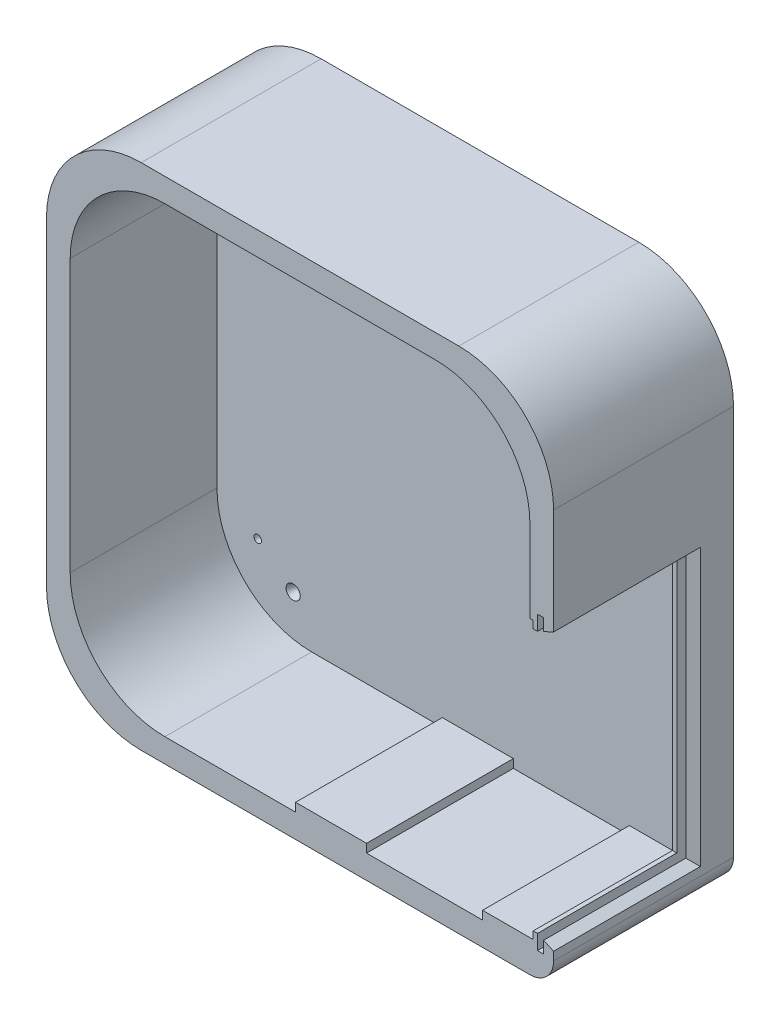
from build123d import *
from OCP.BRepFilletAPI import BRepFilletAPI_MakeChamfer

# Parameters (mm, degrees)
SKETCH1_W           = 97.1
SKETCH1_H           = 97.5
SKETCH1_R           = 0.8
BOSS_EXTRUDE1_DEPTH = 7
CUT_EXTRUDE1_DEPTH  = 3
SKETCH3_W           = 107.1
SKETCH3_H           = 107.5
SKETCH3_W_2         = 97.1
SKETCH3_H_2         = 97.5
BOSS_EXTRUDE2_DEPTH = 7
SKETCH4_W           = 107.1
SKETCH4_H           = 107.5
SKETCH4_W_2         = 97.1
SKETCH4_H_2         = 97.5
BOSS_EXTRUDE3_DEPTH = 31
SKETCH5_W           = 31
SKETCH5_H           = 58
CUT_EXTRUDE2_DEPTH  = 33
MOVE_FACE2_BY       = 10
MOVE_FACE3_BY       = 0.2
SKETCH6_W           = 15
SKETCH6_H           = 31
BOSS_EXTRUDE4_DEPTH = 1.8
MOVE_FACE4_BY       = 0.2
BOSS_EXTRUDE5_DEPTH = 31
BOSS_EXTRUDE6_DEPTH = 58.4
SKETCH13_R          = 1.5
SKETCH14_R          = 0.8
SKETCH13_4_R        = 1.5
SKETCH14_4_R        = 0.8
FILLET2_R           = 20
FILLET3_R           = 20
FILLET4_R           = 20
FILLET5_R           = 20
FILLET6_R           = 5
CHAMFER1_SIZE       = 1
CHAMFER1_SIZE2      = 0.421668948
SKETCH16_R          = 0.8
CUT_EXTRUDE3_DEPTH  = 87.094424907
SKETCH20_W          = 1.3
SKETCH20_H          = 61.543461502
CUT_EXTRUDE4_DEPTH  = 32.62
BOSS_EXTRUDE7_DEPTH = 20
SKETCH25_R          = 7.25
BOSS_EXTRUDE8_DEPTH = 4.5
SKETCH24_R          = 5.75
SKETCH23_R          = 4
SKETCH26_R          = 4
CUT_EXTRUDE5_DEPTH  = 4.5
CUT_EXTRUDE6_DEPTH  = 34.5
CUT_EXTRUDE7_DEPTH  = 34.5
SKETCH34_R          = 3
CUT_EXTRUDE9_DEPTH  = 3
SKETCH36_R          = 1.5
SKETCH35_R          = 0.8
SKETCH36_3_R        = 1.5
SKETCH35_3_R        = 0.8


with BuildPart() as part:
    # Sketch1 → Boss-Extrude1 (new body)
    with BuildSketch(Plane.XY):
        with Locations((0.95, -5.25)):
            Rectangle(SKETCH1_W, SKETCH1_H)
        with Locations((-31.5, -45)):
            Circle(SKETCH1_R, mode=Mode.SUBTRACT)
        with Locations((26, 39)):
            Circle(SKETCH1_R, mode=Mode.SUBTRACT)
    extrude(amount=BOSS_EXTRUDE1_DEPTH)

    # Sketch2 → Cut-Extrude1 (cut)
    with BuildSketch(Plane(origin=(0, 0, 0), x_dir=(-1, 0, 0), z_dir=(0, 0, -1))):
        Polygon((-24.4, 36.228718708), (-22.8, 39), (-24.4, 41.771281292), (-27.6, 41.771281292), (-29.2, 39), (-27.6, 36.228718708), align=None)
        Polygon((33.1, -47.771281292), (34.7, -45), (33.1, -42.228718708), (29.9, -42.228718708), (28.3, -45), (29.9, -47.771281292), align=None)
    extrude(amount=-CUT_EXTRUDE1_DEPTH, mode=Mode.SUBTRACT)

    # Sketch3 → Boss-Extrude2 (add)
    with BuildSketch(Plane.XY.offset(7)):
        with Locations((0.95, -5.25)):
            Rectangle(SKETCH3_W, SKETCH3_H)
        with Locations((0.95, -5.25)):
            Rectangle(SKETCH3_W_2, SKETCH3_H_2, mode=Mode.SUBTRACT)
    extrude(amount=-BOSS_EXTRUDE2_DEPTH)

    # Sketch4 → Boss-Extrude3 (add)
    with BuildSketch(Plane.XY.offset(7)):
        with Locations((0.95, -5.25)):
            Rectangle(SKETCH4_W, SKETCH4_H)
        with Locations((0.95, -5.25)):
            Rectangle(SKETCH4_W_2, SKETCH4_H_2, mode=Mode.SUBTRACT)
    extrude(amount=BOSS_EXTRUDE3_DEPTH)

    # Sketch5 → Cut-Extrude2 (cut)
    with BuildSketch(Plane(origin=(54.5, 0, 0), x_dir=(0, 0, -1), z_dir=(1, 0, 0))):
        with Locations((-22.5, -23)):
            Rectangle(SKETCH5_W, SKETCH5_H)
    extrude(amount=-CUT_EXTRUDE2_DEPTH, mode=Mode.SUBTRACT)

    # Move Face2: a face moved outward by 10.0
    extrude(part.faces().sort_by_distance((49.5, -53, 22.5))[0], amount=MOVE_FACE2_BY, dir=(-1, 0, 0))

    # Move Face3: a face moved inward by 0.2
    extrude(part.faces().sort_by_distance((47, -52, 22.5))[0], amount=MOVE_FACE3_BY, dir=(0, -1, 0), mode=Mode.SUBTRACT)

    # Sketch6 → Boss-Extrude4 (add)
    with BuildSketch(Plane(origin=(0, -54, 0), x_dir=(1, 0, 0), z_dir=(0, 1, 0))):
        with Locations((7.5, -22.5)):
            Rectangle(SKETCH6_W, SKETCH6_H)
    extrude(amount=BOSS_EXTRUDE4_DEPTH)

    # Move Face4: a face moved inward by 0.2
    extrude(part.faces().sort_by_distance((52, 6, 22.5))[0], amount=MOVE_FACE4_BY, dir=(0, 1, 0), mode=Mode.SUBTRACT)

    # Sketch10 → Boss-Extrude5 (add)
    with BuildSketch(Plane.XY.offset(7)):
        Polygon((54.5, 6.2), (50.2, 6.2), (50.2, 4.2), align=None)
        Polygon((54.5, -52.2), (50.2, -52.2), (50.2, -50.2), align=None)
    extrude(amount=BOSS_EXTRUDE5_DEPTH)

    # Sketch11 → Boss-Extrude6 (add)
    with BuildSketch(Plane.XZ.offset(-6.2)):
        Polygon((50.2, 7), (54.5, 7), (50.2, 9), align=None)
    extrude(amount=BOSS_EXTRUDE6_DEPTH)

    # Sketch13 → Cut-Loft1 section 0
    with BuildSketch(Plane.XY.offset(7)):
        with Locations((-31.5, -45)):
            Circle(SKETCH13_R)
    # Sketch14 → Cut-Loft1 section 1
    with BuildSketch(Plane.XY.offset(5.4)):
        with Locations((-31.5, -45)):
            Circle(SKETCH14_R)
    loft(mode=Mode.SUBTRACT)

    # Sketch13<4> → Cut-Loft2 section 0
    with BuildSketch(Plane.XY.offset(7)):
        with Locations((26, 39)):
            Circle(SKETCH13_4_R)
    # Sketch14<4> → Cut-Loft2 section 1
    with BuildSketch(Plane.XY.offset(5.4)):
        with Locations((26, 39)):
            Circle(SKETCH14_4_R)
    loft(mode=Mode.SUBTRACT)

    # Fillet2
    fillet2_edges = [part.edges().sort_by_distance(p)[0] for p in [
        (-47.6, 43.5, 22.5),
    ]]
    fillet(fillet2_edges, radius=FILLET2_R)

    # Fillet3
    fillet3_edges = [part.edges().sort_by_distance(p)[0] for p in [
        (-47.6, -54, 22.5),
    ]]
    fillet(fillet3_edges, radius=FILLET3_R)

    # Fillet4
    fillet4_edges = [part.edges().sort_by_distance(p)[0] for p in [
        (49.5, 43.5, 22.5),
    ]]
    fillet(fillet4_edges, radius=FILLET4_R)

    # Fillet5
    fillet5_edges = [part.edges().sort_by_distance(p)[0] for p in [
        (-52.6, 48.5, 19),
        (54.5, 48.5, 19),
        (-52.6, -59, 19),
    ]]
    fillet(fillet5_edges, radius=FILLET5_R)

    # Fillet6
    fillet6_edges = [part.edges().sort_by_distance(p)[0] for p in [
        (54.5, -59, 19),
    ]]
    fillet(fillet6_edges, radius=FILLET6_R)

    # Chamfer1: one chamfer whose edges measure the first distance from different faces: ONE call of the kernel's chamfer builder (chamfer() names one face for all edges)
    chamfer1_edges_1 = [part.edges().sort_by_distance(p)[0] for p in [
        (50.2, 4.2, 23.5),
    ]]
    chamfer1_side_1 = [part.faces().sort_by_distance(p)[0] for p in [
        (52.373888889, 5.211111111, 22.994444444),
    ]]
    chamfer1_edges_2 = [part.edges().sort_by_distance(p)[0] for p in [
        (50.2, -50.2, 23.5),
    ]]
    chamfer1_side_2 = [part.faces().sort_by_distance(p)[0] for p in [
        (52.373888889, -51.211111111, 22.994444444),
    ]]
    chamfer1_edges_3 = [part.edges().sort_by_distance(p)[0] for p in [
        (50.2, -23, 9),
    ]]
    chamfer1_side_3 = [part.faces().sort_by_distance(p)[0] for p in [
        (52.375413712, -23, 7.988179669),
    ]]
    chamfer1 = BRepFilletAPI_MakeChamfer(part.part.solid().wrapped)
    for e in chamfer1_edges_1:
        chamfer1.Add(CHAMFER1_SIZE, CHAMFER1_SIZE2, e.wrapped, chamfer1_side_1[0].wrapped)  # the first distance lies on this face
    for e in chamfer1_edges_2:
        chamfer1.Add(CHAMFER1_SIZE, CHAMFER1_SIZE2, e.wrapped, chamfer1_side_2[0].wrapped)  # the first distance lies on this face
    for e in chamfer1_edges_3:
        chamfer1.Add(CHAMFER1_SIZE, CHAMFER1_SIZE2, e.wrapped, chamfer1_side_3[0].wrapped)  # the first distance lies on this face
    add(Compound.cast(chamfer1.Shape()), mode=Mode.REPLACE)

    # Sketch16 → Cut-Extrude3 (cut, through all)
    with BuildSketch(Plane.XY.offset(7)):
        with Locations((32, 32)):
            Circle(SKETCH16_R)
        with Locations((-39, -39)):
            Circle(SKETCH16_R)
    extrude(amount=-CUT_EXTRUDE3_DEPTH, mode=Mode.SUBTRACT)

    # Sketch20 → Cut-Extrude4 (cut)
    with BuildSketch(Plane.XY.offset(38)):
        with Locations((51.756630498, -23)):
            Rectangle(SKETCH20_W, SKETCH20_H)
    extrude(amount=-CUT_EXTRUDE4_DEPTH, mode=Mode.SUBTRACT)


with BuildPart() as body_2:
    # Sketch21 → Boss-Extrude7 (new body)
    with BuildSketch(Plane.XY.offset(7)):
        with BuildLine():
            ThreePointArc((44.045644952, 24.711613463), (46.890543586, 26.651851916), (48.519348561, 29.685820908))
            ThreePointArc((48.519348561, 29.685820908), (47.841657822, 31.4739318), (46.996296574, 33.189148889))
            ThreePointArc((46.996296574, 33.189148889), (47.186220419, 32.354047627), (47.25, 31.5))
            ThreePointArc((47.25, 31.5), (36.295038241, 29.056462997), (45.17317458, 35.923831881))
            ThreePointArc((45.17317458, 35.923831881), (43.915036208, 37.36386422), (42.525122593, 38.677159861))
            ThreePointArc((42.525122593, 38.677159861), (39.395877764, 38.437951399), (36.660912672, 36.898678897))
            ThreePointArc((36.660912672, 36.898678897), (35.299507241, 27.742821598), (44.045644952, 24.711613463))
        make_face()
        with BuildLine():
            ThreePointArc((46.996296574, 33.189148889), (47.841657822, 31.4739318), (48.519348561, 29.685820908))
            ThreePointArc((48.519348561, 29.685820908), (48.692105987, 30.585608691), (48.75, 31.5))
            ThreePointArc((48.75, 31.5), (46.976980865, 36.25028216), (42.525122593, 38.677159861))
            ThreePointArc((42.525122593, 38.677159861), (43.915036208, 37.36386422), (45.17317458, 35.923831881))
            ThreePointArc((45.17317458, 35.923831881), (46.284289192, 34.689526128), (46.996296574, 33.189148889))
        make_face()
    extrude(amount=BOSS_EXTRUDE7_DEPTH)


with BuildPart() as body_3:
    # Sketch25 → Boss-Extrude8 (new body)
    with BuildSketch(Plane.XY.offset(27)):
        with Locations((41.5, 31.5)):
            Circle(SKETCH25_R)
    extrude(amount=BOSS_EXTRUDE8_DEPTH)


with BuildPart() as cut_loft5_tool:
    # Sketch24 → Cut-Loft5 section 0
    with BuildSketch(Plane.XY.offset(27)):
        with Locations((41.5, 31.5)):
            Circle(SKETCH24_R)
    # Sketch23 → Cut-Loft5 section 1
    with BuildSketch(Plane.XY.offset(28.5)):
        with Locations((41.5, 31.5)):
            Circle(SKETCH23_R)
    loft()


with BuildPart() as part_1:
    add(part.part)

    # Cut-Loft5: cut by cut_loft5_tool
    add(cut_loft5_tool.part, mode=Mode.SUBTRACT)

    # Sketch31 → Cut-Extrude7 (cut)
    with BuildSketch(Plane.XY.offset(7)):
        with BuildLine():
            ThreePointArc((45.17317458, 35.923831881), (36.715710808, 28.310473872), (46.996296574, 33.189148889))
            ThreePointArc((46.996296574, 33.189148889), (46.141005887, 34.594003925), (45.17317458, 35.923831881))
        make_face()
    extrude(amount=-CUT_EXTRUDE7_DEPTH, mode=Mode.SUBTRACT)

    # Sketch34 → Cut-Extrude9 (cut)
    with BuildSketch(Plane(origin=(0, 0, 0), x_dir=(-1, 0, 0), z_dir=(0, 0, -1))):
        with Locations((-32, 32)):
            Circle(SKETCH34_R)
        with Locations((39, -39)):
            Circle(SKETCH34_R)
    extrude(amount=-CUT_EXTRUDE9_DEPTH, mode=Mode.SUBTRACT)

    # Sketch36 → Cut-Loft6 section 0
    with BuildSketch(Plane(origin=(0, 0, 3), x_dir=(-1, 0, 0), z_dir=(0, 0, -1))):
        with Locations((39, -39)):
            Circle(SKETCH36_R)
    # Sketch35 → Cut-Loft6 section 1
    with BuildSketch(Plane(origin=(0, 0, 4.6), x_dir=(-1, 0, 0), z_dir=(0, 0, -1))):
        with Locations((39, -39)):
            Circle(SKETCH35_R)
    loft(mode=Mode.SUBTRACT)

    # Sketch36<3> → Cut-Loft7 section 0
    with BuildSketch(Plane(origin=(0, 0, 3), x_dir=(-1, 0, 0), z_dir=(0, 0, -1))):
        with Locations((-32, 32)):
            Circle(SKETCH36_3_R)
    # Sketch35<3> → Cut-Loft7 section 1
    with BuildSketch(Plane(origin=(0, 0, 4.6), x_dir=(-1, 0, 0), z_dir=(0, 0, -1))):
        with Locations((-32, 32)):
            Circle(SKETCH35_3_R)
    loft(mode=Mode.SUBTRACT)


with BuildPart() as body_3_1:
    add(body_3.part)

    # Cut-Loft5: cut by cut_loft5_tool
    add(cut_loft5_tool.part, mode=Mode.SUBTRACT)

    # Sketch26 → Cut-Extrude5 (cut)
    with BuildSketch(Plane(origin=(0, 0, 28.5), x_dir=(-1, 0, 0), z_dir=(0, 0, -1))):
        with Locations((-41.5, 31.5)):
            Circle(SKETCH26_R)
    extrude(amount=-CUT_EXTRUDE5_DEPTH, mode=Mode.SUBTRACT)

    # Sketch28 → Cut-Revolve1 (revolve, cut)
    with BuildSketch(Plane(origin=(0, 31.5, 0), x_dir=(-1, 0, 0), z_dir=(0, -1, 0)), mode=Mode.PRIVATE) as cut_revolve1_sk:
        Polygon((-34.25, -31.5), (-34.25, -27), (-36, -31.5), align=None)
    revolve(cut_revolve1_sk.sketch.rotate(Axis((41.5, 31.5, 31.5), (0, 0, -1)), 180), axis=Axis((41.5, 31.5, 31.5), (0, 0, -1)), mode=Mode.SUBTRACT)


with BuildPart() as cut_extrude6_tool:
    # Sketch30 → Cut-Extrude6 (new body)
    with BuildSketch(Plane.XY.offset(7)):
        Polygon((41.5, 31.5), (36.660912672, 36.898678897), (28.18676226, 29.302903216), (36.772796235, 19.723981141), (44.045644952, 24.711613463), align=None)
    extrude(amount=CUT_EXTRUDE6_DEPTH)


with BuildPart() as body_2_1:
    add(body_2.part)

    # Cut-Extrude6: cut by cut_extrude6_tool
    add(cut_extrude6_tool.part, mode=Mode.SUBTRACT)


with BuildPart() as body_3_2:
    add(body_3_1.part)

    # Cut-Extrude6: cut by cut_extrude6_tool
    add(cut_extrude6_tool.part, mode=Mode.SUBTRACT)


solid = Compound([part_1.part, body_2_1.part, body_3_2.part])
